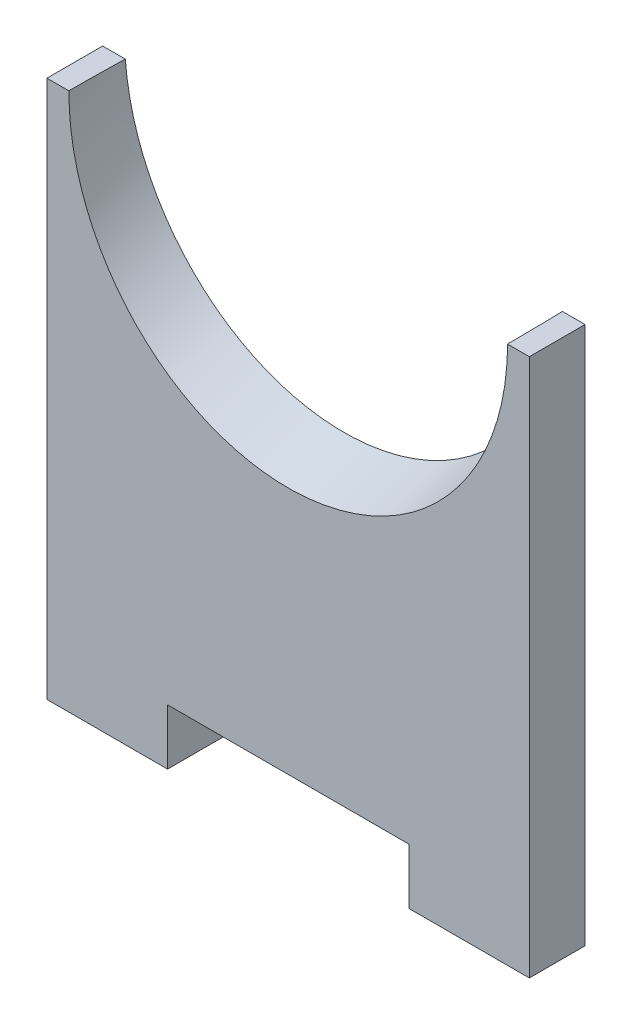
from build123d import *

# Parameters (mm, degrees)
BOSS_EXTRUDE1_DEPTH     = 6.35
CUT_EXTRUDE1_DEPTH      = 77.97632097
CUT_EXTRUDE1_DEPTH_BACK = 77.97632097
SKETCH10_R              = 25.000000038


with BuildPart() as part:
    # Sketch2 → Boss-Extrude1 (new body)
    with BuildSketch(Plane.XY):
        Polygon((13.749999995, 0), (41.249999987, 0), (41.249999987, -6.35), (54.999999982, -6.35), (54.999999982, 0), (54.999999982, 54.999999982), (0, 54.999999982), (0, 0), (0, -6.35), (13.749999995, -6.35), align=None)
    extrude(amount=BOSS_EXTRUDE1_DEPTH)

    # Sketch10 → Cut-Extrude1 (cut, two sides: drawn at the far end of the back side and taken through both)
    with BuildSketch(Plane(origin=(0, 4.380293547, -12.034757611), x_dir=(1, 0, 0), z_dir=(0, -0.3420201433256669, 0.9396926207859092)).offset(-CUT_EXTRUDE1_DEPTH_BACK)):
        with Locations((27.499999991, 53.753435198)):
            Circle(SKETCH10_R)
    extrude(amount=CUT_EXTRUDE1_DEPTH + CUT_EXTRUDE1_DEPTH_BACK, mode=Mode.SUBTRACT)


solid = part.part
